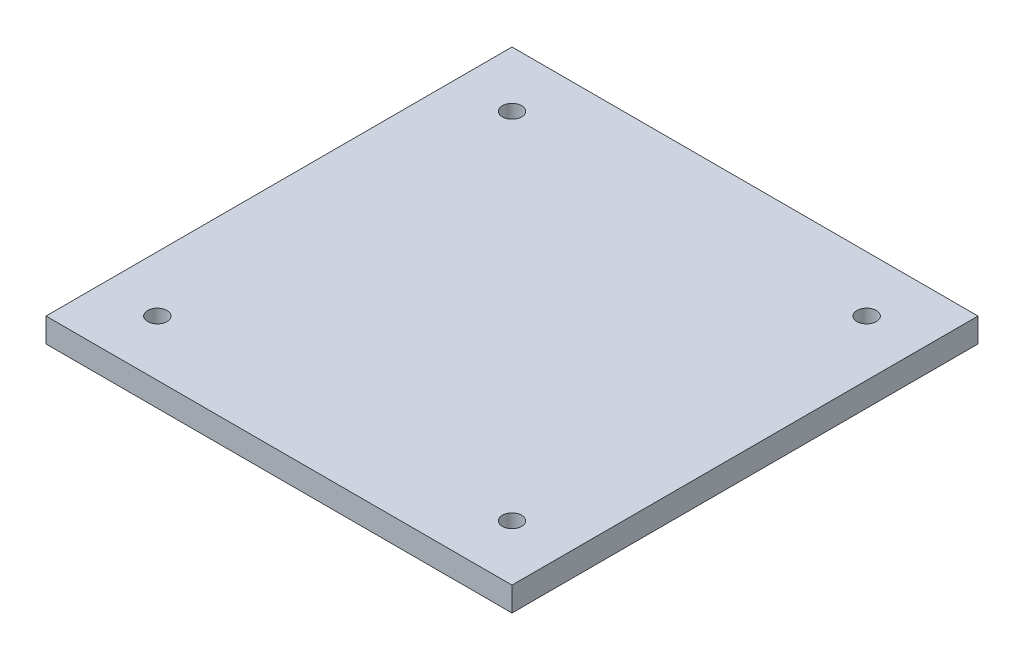
from build123d import *

# Parameters (mm, degrees)
SKETCH1_W             = 38.5
SKETCH1_H             = 38.5
BOSS_EXTRUDE1_DEPTH   = 2
M2X0_4_TAPPED_HOLE1_D = 1.6


with BuildPart() as part:
    # Sketch1 → Boss-Extrude1 (new body)
    with BuildSketch(Plane(origin=(0, 0, 0), x_dir=(1, 0, 0), z_dir=(0, 1, 0))):
        with Locations((-0.334475449, -6.202777778)):
            Rectangle(SKETCH1_W, SKETCH1_H)
    extrude(amount=BOSS_EXTRUDE1_DEPTH)

    # M2x0.4 Tapped Hole1 (through all)
    with Locations(Plane(origin=(-14.984475449, 2, -8.447222222), x_dir=(0, 0, 1), z_dir=(0, 1, 0))):
        with Locations((0, 0), (29.3, 29.3), (0, 29.3), (29.3, 0)):
            Hole(M2X0_4_TAPPED_HOLE1_D / 2)


solid = part.part
